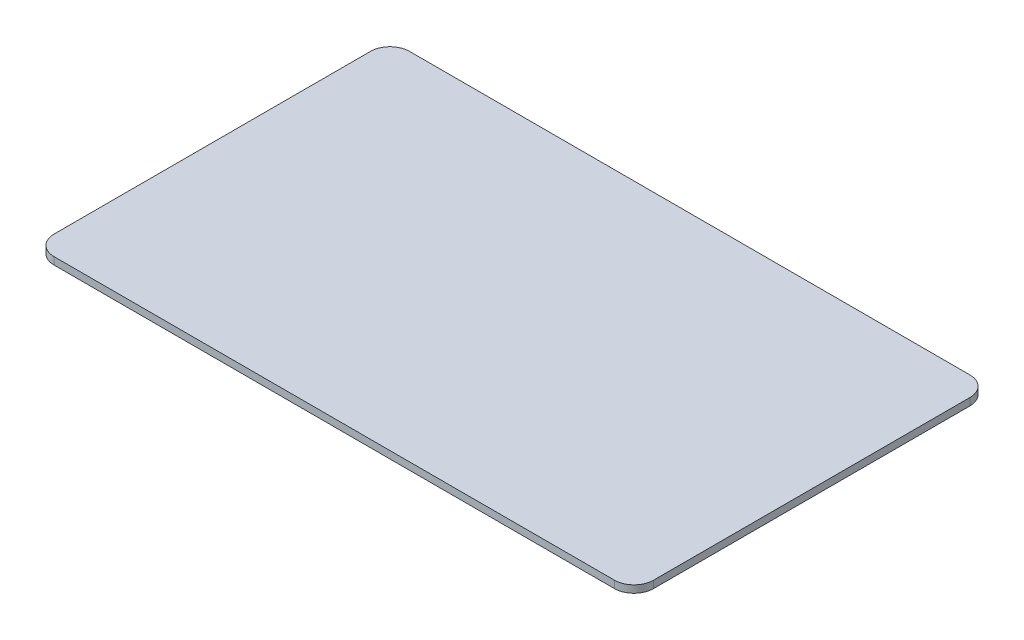
from build123d import *

# Parameters (mm, degrees)
SALIENTE_EXTRUIR1_DEPTH = 1.5


with BuildPart() as part:
    # Croquis1 → Saliente-Extruir1 (new, symmetric)
    with BuildSketch(Plane(origin=(0, 0, 0), x_dir=(1, 0, 0), z_dir=(0, 1, 0))):
        with BuildLine():
            Line((-114.85, -72.85), (114.85, -72.85))
            ThreePointArc((114.85, -72.85), (120.506854249, -70.506854249), (122.85, -64.85))
            Line((122.85, -64.85), (122.85, 64.85))
            ThreePointArc((122.85, 64.85), (120.506854249, 70.506854249), (114.85, 72.85))
            Line((114.85, 72.85), (-114.85, 72.85))
            ThreePointArc((-114.85, 72.85), (-120.506854249, 70.506854249), (-122.85, 64.85))
            Line((-122.85, 64.85), (-122.85, -64.85))
            ThreePointArc((-122.85, -64.85), (-120.506854249, -70.506854249), (-114.85, -72.85))
        make_face()
    extrude(amount=SALIENTE_EXTRUIR1_DEPTH, both=True)


solid = part.part
